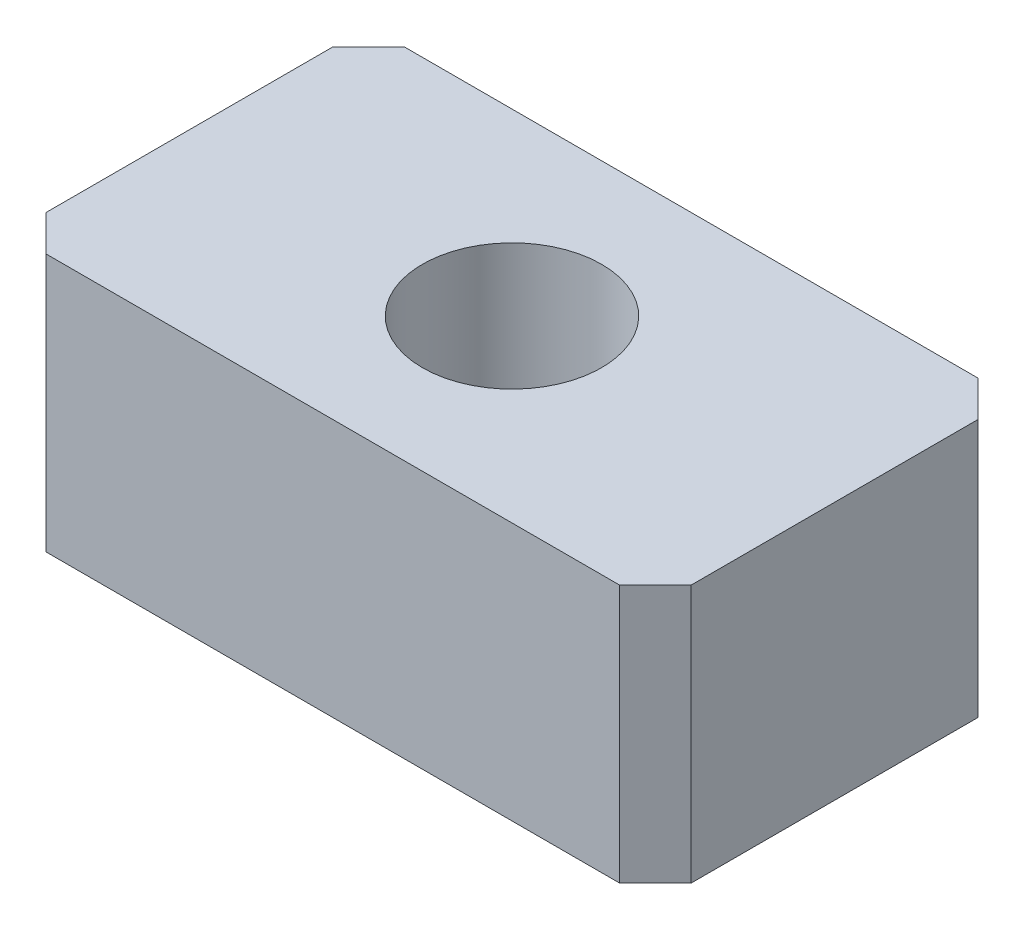
from build123d import *

# Parameters (mm, degrees)
SKETCH1_W           = 18
SKETCH1_H           = 10
BOSS_EXTRUDE1_DEPTH = 7.2
SKETCH2_R           = 2.5
CUT_EXTRUDE1_DEPTH  = 22.813757127
CHAMFER1_SIZE       = 1


with BuildPart() as part:
    # Sketch1 → Boss-Extrude1 (new body)
    with BuildSketch(Plane(origin=(0, 0, 0), x_dir=(1, 0, 0), z_dir=(0, 1, 0))):
        with Locations((-9, 5)):
            Rectangle(SKETCH1_W, SKETCH1_H)
    extrude(amount=BOSS_EXTRUDE1_DEPTH)

    # Sketch2 → Cut-Extrude1 (cut, through all)
    with BuildSketch(Plane(origin=(0, 7.2, 0), x_dir=(1, 0, 0), z_dir=(0, 1, 0))):
        with Locations(Location((-9, 5, 0), (0, 0, 270))):
            Circle(SKETCH2_R)
    extrude(amount=-CUT_EXTRUDE1_DEPTH, mode=Mode.SUBTRACT)

    # Chamfer1
    chamfer1_edges = [part.edges().sort_by_distance(p)[0] for p in [
        (0, 3.6, 0),
        (-18, 3.6, 0),
        (-18, 3.6, -10),
        (0, 3.6, -10),
    ]]
    chamfer(chamfer1_edges, length=CHAMFER1_SIZE)


solid = part.part
